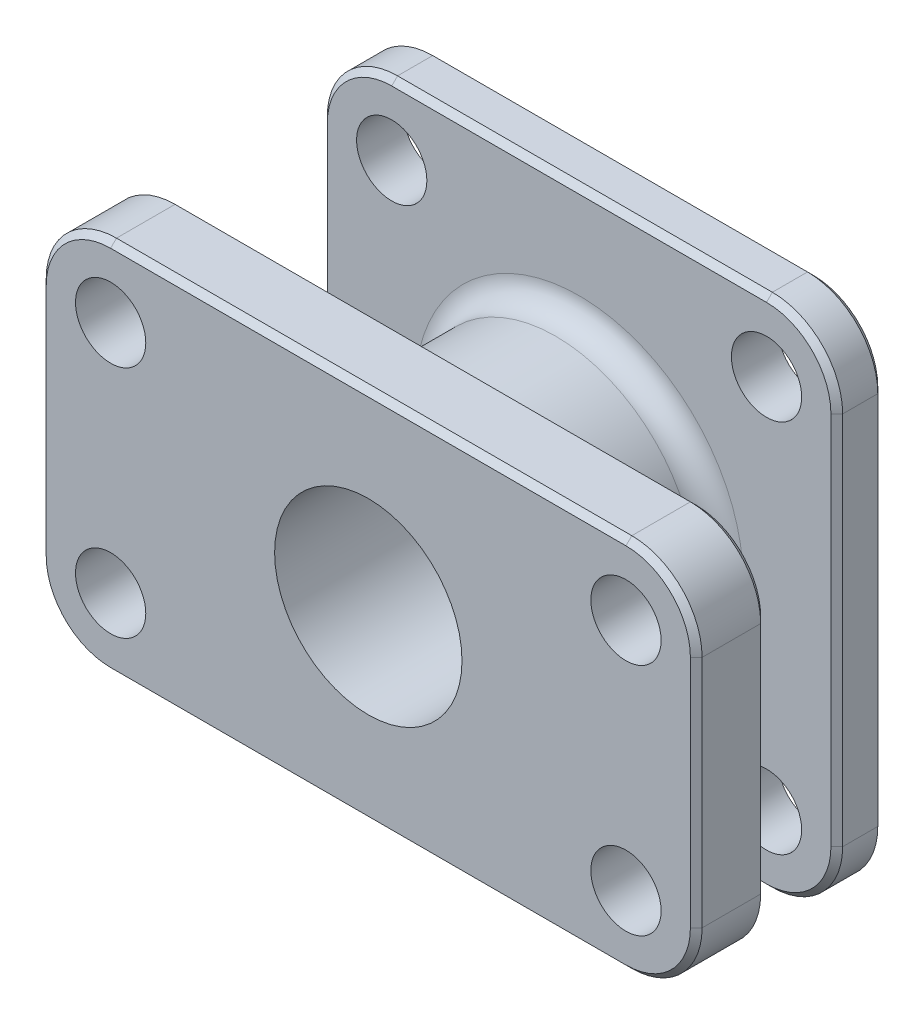
from build123d import *

# Parameters (mm, degrees)
SKETCH1_R           = 1.5
BOSS_EXTRUDE1_DEPTH = 2
SKETCH2_R           = 6
BOSS_EXTRUDE2_DEPTH = 6
SKETCH3_R           = 1.5
BOSS_EXTRUDE3_DEPTH = 3
SKETCH4_R           = 4
CUT_EXTRUDE1_DEPTH  = 21.928449536
CHAMFER1_SIZE       = 2
FILLET1_R           = 1
CHAMFER2_SIZE       = 0.25


with BuildPart() as part:
    # Sketch1 → Boss-Extrude1 (new body)
    with BuildSketch(Plane.XY):
        with BuildLine():
            Line((8, -11), (-8, -11))
            ThreePointArc((-8, -11), (-10.121320344, -10.121320344), (-11, -8))
            Line((-11, -8), (-11, 8))
            ThreePointArc((-11, 8), (-10.121320344, 10.121320344), (-8, 11))
            Line((-8, 11), (8, 11))
            ThreePointArc((8, 11), (10.121320344, 10.121320344), (11, 8))
            Line((11, 8), (11, -8))
            ThreePointArc((11, -8), (10.121320344, -10.121320344), (8, -11))
        make_face()
        with Locations((-8, 8)):
            Circle(SKETCH1_R, mode=Mode.SUBTRACT)
        with Locations((8, 8)):
            Circle(SKETCH1_R, mode=Mode.SUBTRACT)
        with Locations((8, -8)):
            Circle(SKETCH1_R, mode=Mode.SUBTRACT)
        with Locations((-8, -8)):
            Circle(SKETCH1_R, mode=Mode.SUBTRACT)
    extrude(amount=BOSS_EXTRUDE1_DEPTH)

    # Sketch2 → Boss-Extrude2 (add)
    with BuildSketch(Plane.XY.offset(2)):
        Circle(SKETCH2_R)
    extrude(amount=BOSS_EXTRUDE2_DEPTH)

    # Sketch3 → Boss-Extrude3 (add)
    with BuildSketch(Plane.XY.offset(8)):
        with BuildLine():
            Line((11, -8), (-11, -8))
            ThreePointArc((-11, -8), (-13.121320344, -7.121320344), (-14, -5))
            Line((-14, -5), (-14, 5))
            ThreePointArc((-14, 5), (-13.121320344, 7.121320344), (-11, 8))
            Line((-11, 8), (11, 8))
            ThreePointArc((11, 8), (13.121320344, 7.121320344), (14, 5))
            Line((14, 5), (14, -5))
            ThreePointArc((14, -5), (13.121320344, -7.121320344), (11, -8))
        make_face()
        with Locations((-11, 5)):
            Circle(SKETCH3_R, mode=Mode.SUBTRACT)
        with Locations((11, 5)):
            Circle(SKETCH3_R, mode=Mode.SUBTRACT)
        with Locations((11, -5)):
            Circle(SKETCH3_R, mode=Mode.SUBTRACT)
        with Locations((-11, -5)):
            Circle(SKETCH3_R, mode=Mode.SUBTRACT)
    extrude(amount=BOSS_EXTRUDE3_DEPTH)

    # Sketch4 → Cut-Extrude1 (cut, through all)
    with BuildSketch(Plane(origin=(0, 0, 0), x_dir=(-1, 0, 0), z_dir=(0, 0, -1))):
        Circle(SKETCH4_R)
    extrude(amount=-CUT_EXTRUDE1_DEPTH, mode=Mode.SUBTRACT)

    # Chamfer1
    chamfer1_edges = [part.edges().sort_by_distance(p)[0] for p in [
        (4, 0, 0),
    ]]
    chamfer(chamfer1_edges, length=CHAMFER1_SIZE)

    # Fillet1
    fillet1_edges = [part.edges().sort_by_distance(p)[0] for p in [
        (-6, 0, 2),
        (-6, 0, 8),
    ]]
    fillet(fillet1_edges, radius=FILLET1_R)

    # Chamfer2
    chamfer2_edges = [part.edges().sort_by_distance(p)[0] for p in [
        (-11, 0, 0),
        (-10.121320344, 10.121320344, 0),
        (0, 11, 0),
        (10.121320344, 10.121320344, 0),
        (-10.121320344, 10.121320344, 2),
        (-11, 0, 2),
        (-10.121320344, -10.121320344, 2),
        (0, -11, 2),
        (10.121320344, -10.121320344, 2),
        (11, 0, 2),
        (-13.121320344, -7.121320344, 11),
        (0, -8, 11),
        (13.121320344, -7.121320344, 11),
        (14, 0, 11),
        (13.121320344, 7.121320344, 11),
        (0, 8, 11),
        (-13.121320344, 7.121320344, 11),
        (-14, 0, 11),
        (10.121320344, 10.121320344, 2),
        (-13.121320344, -7.121320344, 8),
        (0, -8, 8),
        (13.121320344, -7.121320344, 8),
        (14, 0, 8),
        (13.121320344, 7.121320344, 8),
        (0, 8, 8),
        (-13.121320344, 7.121320344, 8),
        (-14, 0, 8),
        (11, 0, 0),
        (0, 11, 2),
        (10.121320344, -10.121320344, 0),
        (0, -11, 0),
        (-10.121320344, -10.121320344, 0),
    ]]
    chamfer(chamfer2_edges, length=CHAMFER2_SIZE)


solid = part.part
